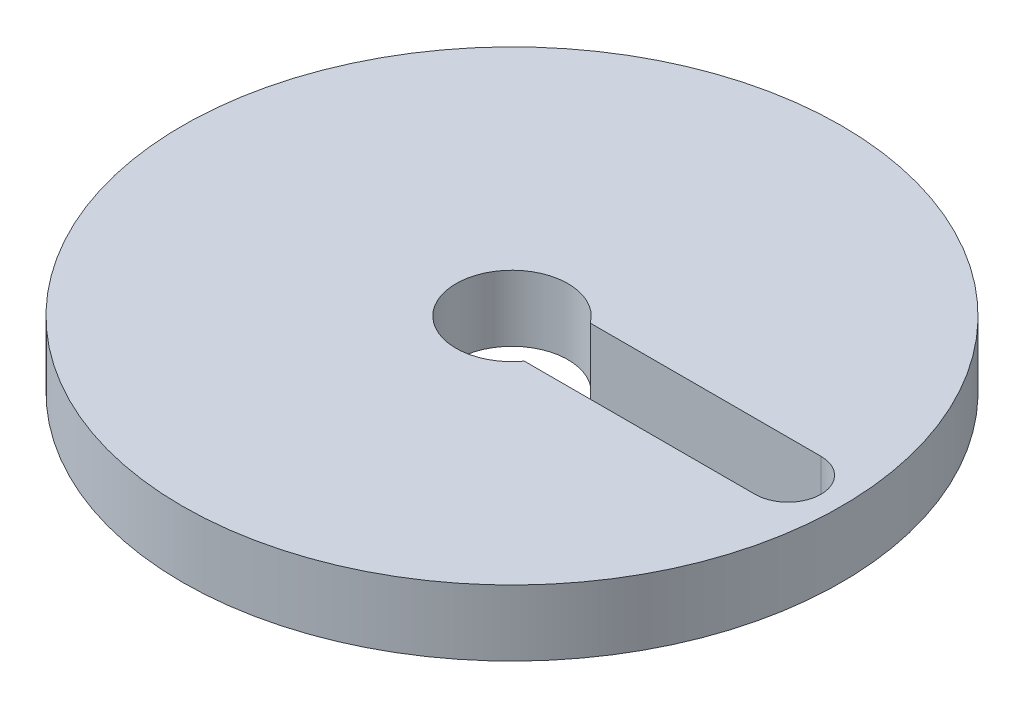
from build123d import *

# Parameters (mm, degrees)
SKETCH1_R           = 10
BOSS_EXTRUDE1_DEPTH = 2


with BuildPart() as part:
    # Sketch1 → Boss-Extrude1 (new body)
    with BuildSketch(Plane(origin=(0, 0, 0), x_dir=(1, 0, 0), z_dir=(0, 1, 0))):
        with Locations(Location((0, 0, 0), (0, 0, 270))):
            Circle(SKETCH1_R)
        with BuildLine():
            Line((1.374772708, 1), (8.374772708, 1))
            ThreePointArc((8.374772708, 1), (9.374772708, 0), (8.374772708, -1))
            Line((8.374772708, -1), (1.374772708, -1))
            ThreePointArc((1.374772708, -1), (-1.7, 0), (1.374772708, 1))
        make_face(mode=Mode.SUBTRACT)
    extrude(amount=BOSS_EXTRUDE1_DEPTH)


solid = part.part
